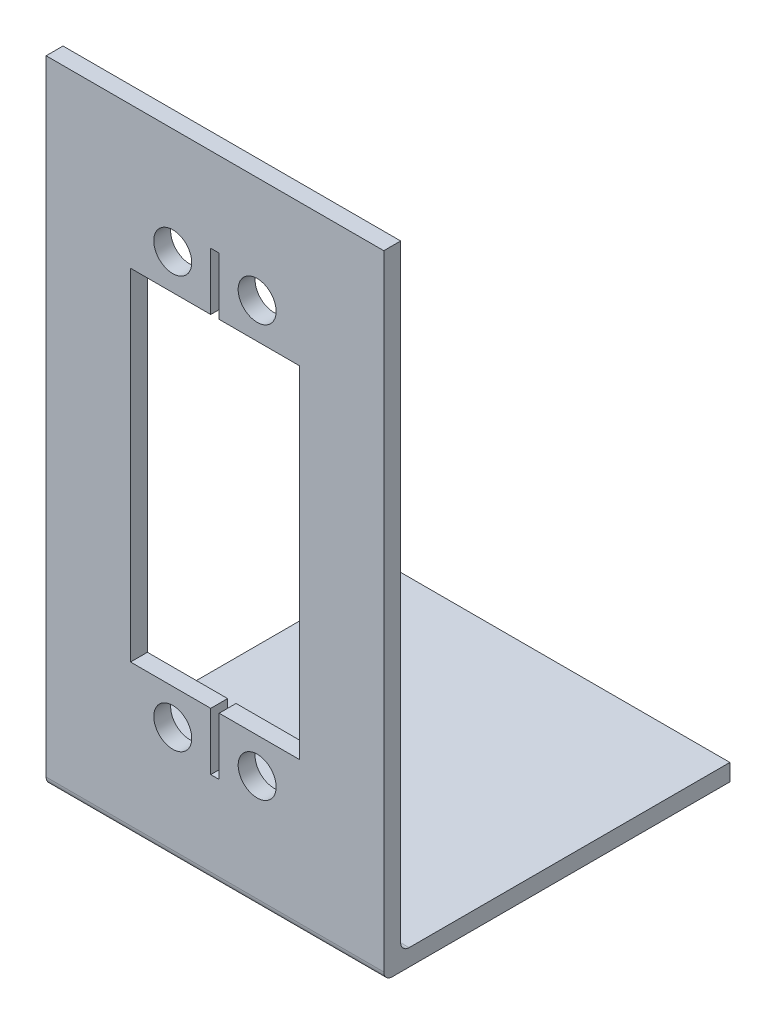
from build123d import *

# Parameters (mm, degrees)
SKETCH1_W                   = 40
SKETCH1_H                   = 40
BOSS_EXTRUDE1_DEPTH         = 2
BOSS_EXTRUDE2_DEPTH         = 73
BOSS_EXTRUDE2_DEPTH_BACK    = 2
SKETCH2_W                   = 40
SKETCH2_H                   = 1
FILLET1_R                   = 1
SKETCH4_R                   = 2.25
SKETCH4_W                   = 0.5
SKETCH4_H                   = 6.8
CUT_EXTRUDE1_DEPTH          = 49
M3_TAPPED_HOLE1_D           = 2.5
M3_TAPPED_HOLE1_CSINK_D     = 3.05
M3_TAPPED_HOLE1_CSINK_ANGLE = 90


with BuildPart() as part:
    # Sketch1 → Boss-Extrude1 (new body)
    with BuildSketch(Plane(origin=(0, 0, 0), x_dir=(1, 0, 0), z_dir=(0, 1, 0))):
        with Locations((20, 20)):
            Rectangle(SKETCH1_W, SKETCH1_H)
    extrude(amount=BOSS_EXTRUDE1_DEPTH)

    # Sketch2 → Boss-Extrude2 (add, two sides: drawn at the far end of the back side and taken through both)
    with BuildSketch(Plane(origin=(0, 2, 0), x_dir=(1, 0, 0), z_dir=(0, 1, 0)).offset(-BOSS_EXTRUDE2_DEPTH_BACK)):
        with Locations((20, 0.5)):
            Rectangle(SKETCH2_W, SKETCH2_H)
        with Locations((20, -0.5)):
            Rectangle(SKETCH2_W, SKETCH2_H)
    extrude(amount=BOSS_EXTRUDE2_DEPTH + BOSS_EXTRUDE2_DEPTH_BACK)

    # Fillet1
    fillet1_edges = [part.edges().sort_by_distance(p)[0] for p in [
        (20, 2, -1),
        (20, 0, 1),
    ]]
    fillet(fillet1_edges, radius=FILLET1_R)

    # Sketch4 → Cut-Extrude1 (cut)
    with BuildSketch(Plane.XY.offset(1)):
        with Locations((15, 62.4)):
            Circle(SKETCH4_R)
        with Locations((19.75, 61.6)):
            Rectangle(SKETCH4_W, SKETCH4_H)
        with Locations((20.25, 61.6)):
            Rectangle(SKETCH4_W, SKETCH4_H)
        with Locations((25, 62.4)):
            Circle(SKETCH4_R)
        Polygon((20.5, 58.2), (20, 58.2), (20, 17.8), (20.5, 17.8), (30, 17.8), (30, 58.2), align=None)
        Polygon((20, 17.8), (20, 58.2), (19.5, 58.2), (10, 58.2), (10, 17.8), (19.5, 17.8), align=None)
        with Locations((19.75, 14.4)):
            Rectangle(SKETCH4_W, SKETCH4_H)
        with Locations((15, 13.6)):
            Circle(SKETCH4_R)
        with Locations((20.25, 14.4)):
            Rectangle(SKETCH4_W, SKETCH4_H)
        with Locations((25, 13.6)):
            Circle(SKETCH4_R)
    extrude(amount=-CUT_EXTRUDE1_DEPTH, mode=Mode.SUBTRACT)

    # M3 Tapped Hole1 (through all)
    with Locations(Plane(origin=(0, 2, 0), x_dir=(1, 0, 0), z_dir=(0, 1, 0))):
        with Locations((20, 15)):
            CounterSinkHole(M3_TAPPED_HOLE1_D / 2, M3_TAPPED_HOLE1_CSINK_D / 2, counter_sink_angle=M3_TAPPED_HOLE1_CSINK_ANGLE)


solid = part.part
